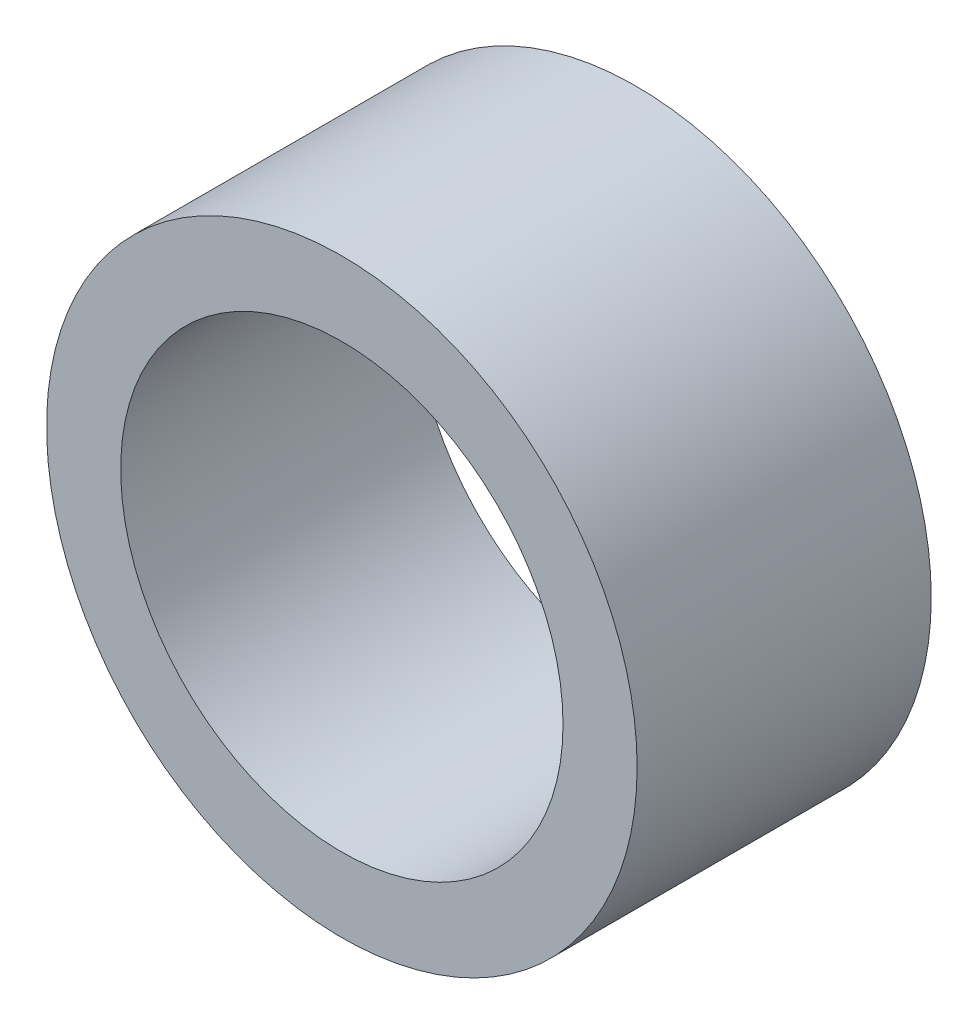
from build123d import *

# Parameters (mm, degrees)
SKETCH1_R      = 6.3754
SKETCH1_R_2    = 4.7752
EXTRUDE1_DEPTH = 3.175


with BuildPart() as part:
    # Sketch1 → Extrude1 (new, symmetric)
    with BuildSketch(Plane.XY):
        Circle(SKETCH1_R)
        Circle(SKETCH1_R_2, mode=Mode.SUBTRACT)
    extrude(amount=EXTRUDE1_DEPTH, both=True)


solid = part.part
